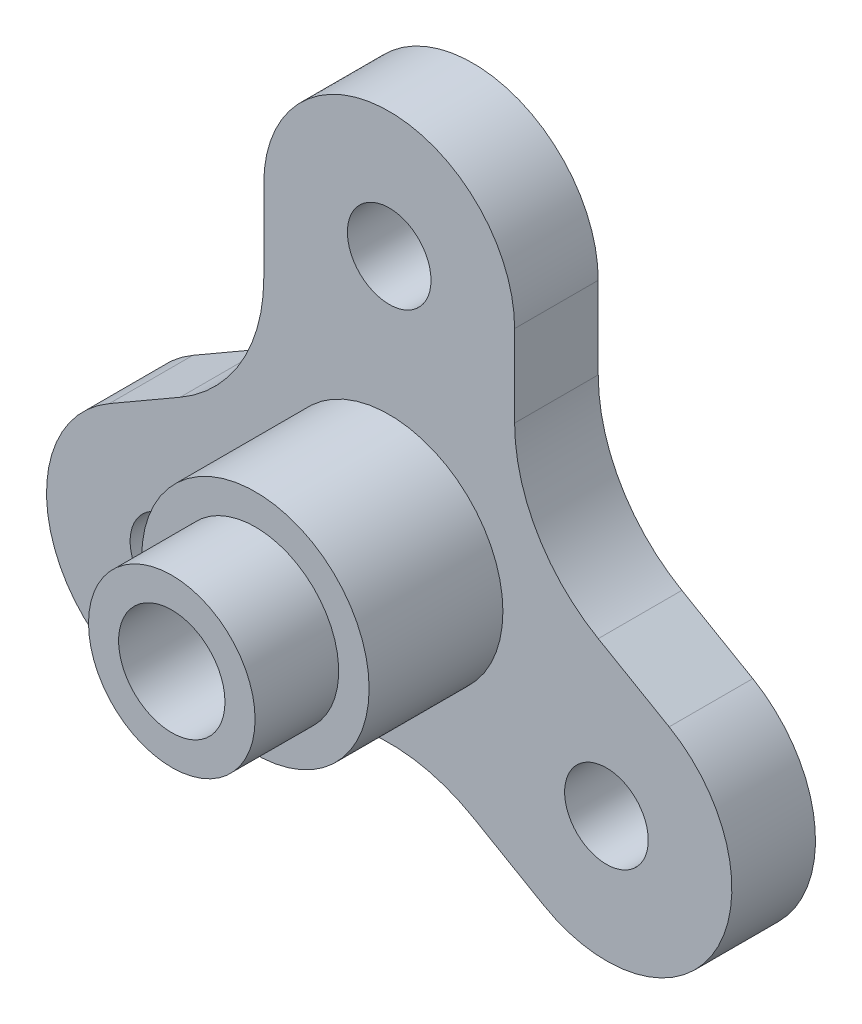
from build123d import *

# Parameters (mm, degrees)
F_1_8_0_1250_DOWEL_HOLE1_D = 3.175
CIRPATTERN2_COUNT          = 3
CUT_EXTRUDE1_START         = -10
SKETCH7_R                  = 15.875
CUT_EXTRUDE1_DEPTH         = 10
FILLET1_R                  = 6.35
BOSS_EXTRUDE1_START        = 3.175
SKETCH11_R                 = 3.1623
SKETCH11_R_2               = 2.0193
BOSS_EXTRUDE1_DEPTH        = 3.175


with BuildPart() as part:
    # Sketch1 → Revolve1 (revolve)
    with BuildSketch(Plane(origin=(0, 0, 0), x_dir=(0, 0, -1), z_dir=(1, 0, 0)), mode=Mode.PRIVATE) as revolve1_sk:
        Polygon((0, 2.0193), (0, 4.318), (5.08, 4.318), (5.08, 15.875), (8.255, 15.875), (8.255, 2.0193), align=None)
    revolve(revolve1_sk.sketch.rotate(Axis((0, 0, 0), (0, 0, -1)), 90), axis=Axis((0, 0, 0), (0, 0, -1)))

    # 1/8 (0.1250) Dowel Hole1 (through all)
    with Locations(Plane.XY.offset(-5.08)):
        with Locations((0, 9.525), (0, 0)):
            f_1_8_0_1250_dowel_hole1 = Hole(F_1_8_0_1250_DOWEL_HOLE1_D / 2)

    # CirPattern2: 1/8 (0.1250) Dowel Hole1 ×3 about axis
    cirpattern2_axis = Axis((0, 0, 0), (0, 0, 1))
    for i in range(1, CIRPATTERN2_COUNT):
        add(f_1_8_0_1250_dowel_hole1.rotate(cirpattern2_axis, i * 360 / CIRPATTERN2_COUNT), mode=Mode.SUBTRACT)

    # Sketch7 → Cut-Extrude1 (cut)
    with BuildSketch(Plane.XY.offset(-5.08).offset(CUT_EXTRUDE1_START)):
        Circle(SKETCH7_R)
        with BuildLine():
            ThreePointArc((-4.7625, 9.525), (0, 14.2875), (4.7625, 9.525))
            Line((4.7625, 9.525), (4.7625, 2.749630657))
            Line((4.7625, 2.749630657), (10.630141971, -0.638054014))
            ThreePointArc((10.630141971, -0.638054014), (12.373337957, -7.14375), (5.867641971, -8.886945986))
            Line((5.867641971, -8.886945986), (0, -5.499261314))
            Line((0, -5.499261314), (-5.867641971, -8.886945986))
            ThreePointArc((-5.867641971, -8.886945986), (-12.373337957, -7.14375), (-10.630141971, -0.638054014))
            Line((-10.630141971, -0.638054014), (-4.7625, 2.749630657))
            Line((-4.7625, 2.749630657), (-4.7625, 9.525))
        make_face(mode=Mode.SUBTRACT)
    extrude(amount=CUT_EXTRUDE1_DEPTH, mode=Mode.SUBTRACT)

    # Fillet1
    fillet1_edges = [part.edges().sort_by_distance(p)[0] for p in [
        (0, -5.499261314, -6.6675),
        (4.7625, 2.749630657, -6.6675),
        (-4.7625, 2.749630657, -6.6675),
    ]]
    fillet(fillet1_edges, radius=FILLET1_R)

    # Sketch11 → Boss-Extrude1 (add)
    with BuildSketch(Plane.XY.offset(BOSS_EXTRUDE1_START)):
        with Locations(Location((0, 0, 0), (0, 0, 180))):
            Circle(SKETCH11_R)
        Circle(SKETCH11_R_2, mode=Mode.SUBTRACT)
    extrude(amount=-BOSS_EXTRUDE1_DEPTH)


solid = part.part
